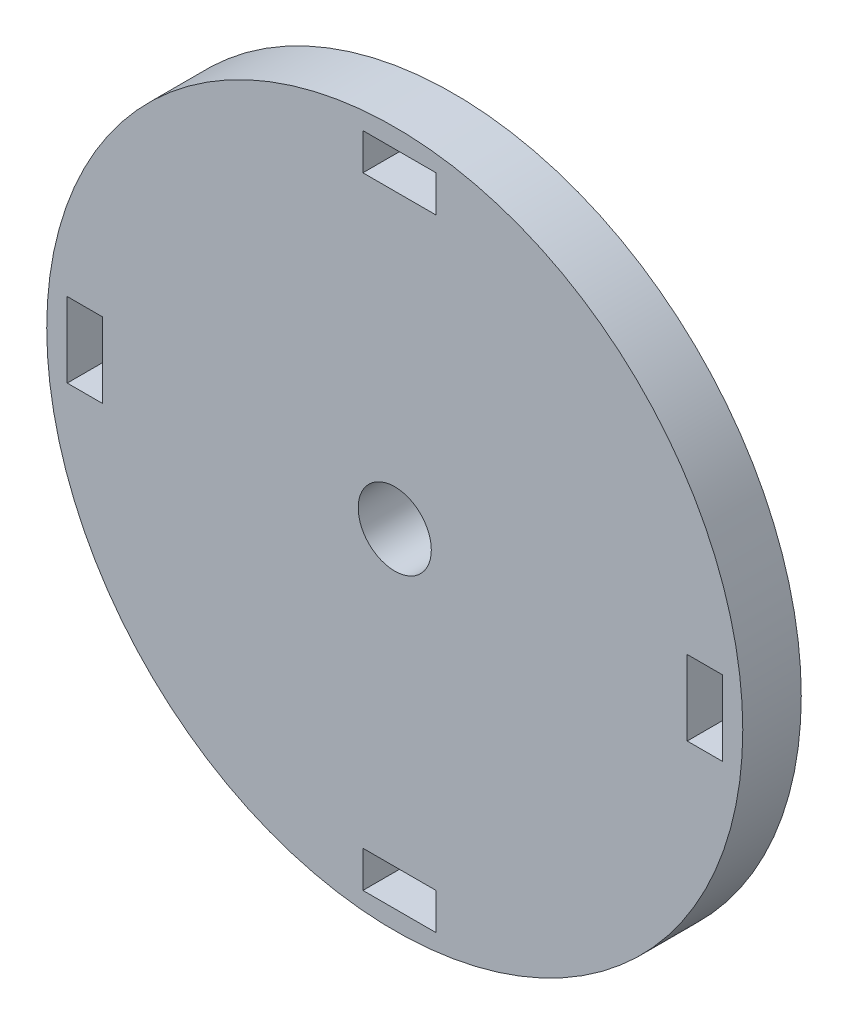
from build123d import *

# Parameters (mm, degrees)
SKETCH1_R           = 11.9
BOSS_EXTRUDE1_DEPTH = 2
CUT_EXTRUDE1_REACH  = 18.948
SKETCH3_W           = 1.198540621
SKETCH3_H           = 2.563545218
CUT_EXTRUDE2_REACH  = 18.948
SKETCH4_R           = 1.25
CUT_EXTRUDE3_REACH  = 18.948
SKETCH5_W           = 2.5
SKETCH5_H           = 1.25


with BuildPart() as part:
    # Sketch1 → Boss-Extrude1 (new body)
    with BuildSketch(Plane.XY):
        Circle(SKETCH1_R)
    extrude(amount=BOSS_EXTRUDE1_DEPTH)

    # Sketch3 → Cut-Extrude1 (cut, up to next)
    with BuildSketch(Plane.XY.offset(2), mode=Mode.PRIVATE) as cut_extrude1_sk1:
        with Locations((10.59927031, 0)):
            Rectangle(SKETCH3_W, SKETCH3_H)
    cut_extrude1_tool1 = extrude(cut_extrude1_sk1.sketch, amount=-CUT_EXTRUDE1_REACH, mode=Mode.PRIVATE) & part.part
    # Sketch3 → Cut-Extrude1 (cut, up to next)
    with BuildSketch(Plane.XY.offset(2), mode=Mode.PRIVATE) as cut_extrude1_sk2:
        with Locations((-10.59927031, 0)):
            Rectangle(SKETCH3_W, SKETCH3_H)
    cut_extrude1_tool2 = extrude(cut_extrude1_sk2.sketch, amount=-CUT_EXTRUDE1_REACH, mode=Mode.PRIVATE) & part.part
    add(cut_extrude1_tool1.solids().sort_by_distance((10.59927, 0, 2))[0], mode=Mode.SUBTRACT)
    add(cut_extrude1_tool2.solids().sort_by_distance((-10.59927, 0, 2))[0], mode=Mode.SUBTRACT)

    # Sketch4 → Cut-Extrude2 (cut, up to next)
    with BuildSketch(Plane.XY.offset(2), mode=Mode.PRIVATE) as cut_extrude2_sk1:
        Circle(SKETCH4_R)
    cut_extrude2_tool1 = extrude(cut_extrude2_sk1.sketch, amount=-CUT_EXTRUDE2_REACH, mode=Mode.PRIVATE) & part.part
    add(cut_extrude2_tool1.solids().sort_by_distance((0, 0, 2))[0], mode=Mode.SUBTRACT)

    # Sketch5 → Cut-Extrude3 (cut, up to next)
    with BuildSketch(Plane(origin=(0, 0, 0), x_dir=(-1, 0, 0), z_dir=(0, 0, -1)), mode=Mode.PRIVATE) as cut_extrude3_sk1:
        with Locations((-0.161415602, -10.625)):
            Rectangle(SKETCH5_W, SKETCH5_H)
    cut_extrude3_tool1 = extrude(cut_extrude3_sk1.sketch, amount=-CUT_EXTRUDE3_REACH, mode=Mode.PRIVATE) & part.part
    # Sketch5 → Cut-Extrude3 (cut, up to next)
    with BuildSketch(Plane(origin=(0, 0, 0), x_dir=(-1, 0, 0), z_dir=(0, 0, -1)), mode=Mode.PRIVATE) as cut_extrude3_sk2:
        with Locations((-0.161415602, 10.625)):
            Rectangle(SKETCH5_W, SKETCH5_H)
    cut_extrude3_tool2 = extrude(cut_extrude3_sk2.sketch, amount=-CUT_EXTRUDE3_REACH, mode=Mode.PRIVATE) & part.part
    add(cut_extrude3_tool1.solids().sort_by_distance((0.161416, -10.625, 0))[0], mode=Mode.SUBTRACT)
    add(cut_extrude3_tool2.solids().sort_by_distance((0.161416, 10.625, 0))[0], mode=Mode.SUBTRACT)


solid = part.part
